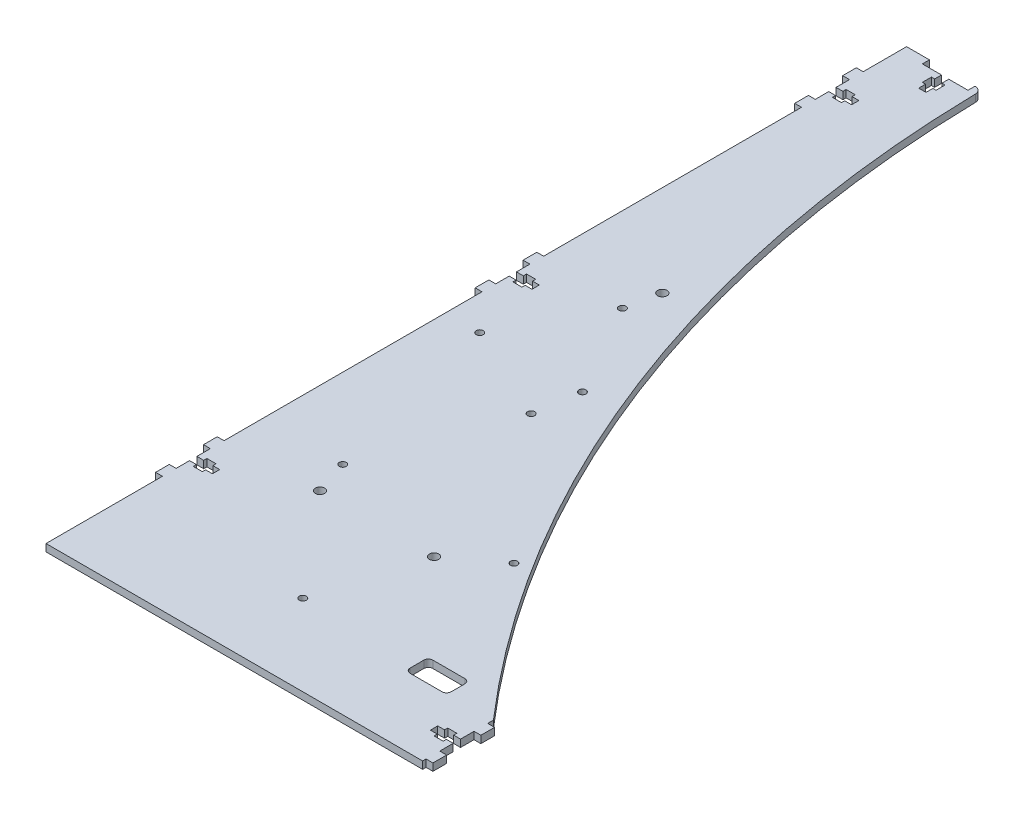
from build123d import *

# Parameters (mm, degrees)
SALIENTE_EXTRUIR1_DEPTH = 3.2
CORTAR_EXTRUIR1_DEPTH   = 3.2
REDONDEO1_R             = 3
CROQUIS3_R              = 2.05
CORTAR_EXTRUIR2_DEPTH   = 3.2
CORTAR_EXTRUIR3_DEPTH   = 3.2
CROQUIS5_R              = 1.55
CORTAR_EXTRUIR4_DEPTH   = 3.2


with BuildPart() as part:
    # Croquis1 → Saliente-Extruir1 (new body)
    with BuildSketch(Plane(origin=(0, 0, 0), x_dir=(1, 0, 0), z_dir=(0, 1, 0))):
        Polygon((7, 66.1), (10, 66.1), (10, 62.9), (7, 62.9), (7, 61.5), (3, 61.5), (3, 62.9), (0, 62.9), (0, 57), (-3, 57), (-3, 51), (0, 51), (0, 0), (165, 0), (165, 1.5), (168, 1.5), (168, 7.5), (165, 7.5), (165, 13.4), (162, 13.4), (162, 12), (158, 12), (158, 13.4), (155, 13.4), (155, 16.6), (158, 16.6), (158, 18), (162, 18), (162, 16.6), (165, 16.6), (165, 22.5), (168, 22.5), (168, 28.5), (165, 28.5), (165, 377), (30, 377), (30, 373.9), (21.6, 373.9), (21.6, 370.9), (23, 370.9), (23, 366.9), (21.6, 366.9), (21.6, 363.9), (18.4, 363.9), (18.4, 366.9), (17, 366.9), (17, 370.9), (18.4, 370.9), (18.4, 373.9), (10, 373.9), (10, 377), (0, 377), (0, 358), (-3, 358), (-3, 352), (0, 352), (0, 346.1), (3, 346.1), (3, 347.5), (7, 347.5), (7, 346.1), (10, 346.1), (10, 342.9), (7, 342.9), (7, 341.5), (3, 341.5), (3, 342.9), (0, 342.9), (0, 337), (-3, 337), (-3, 331), (0, 331), (0, 218), (-3, 218), (-3, 212), (0, 212), (0, 206.1), (3, 206.1), (3, 207.5), (7, 207.5), (7, 206.1), (10, 206.1), (10, 202.9), (7, 202.9), (7, 201.5), (3, 201.5), (3, 202.9), (0, 202.9), (0, 197), (-3, 197), (-3, 191), (0, 191), (0, 78), (-3, 78), (-3, 72), (0, 72), (0, 66.1), (3, 66.1), (3, 67.5), (7, 67.5), align=None)
    extrude(amount=SALIENTE_EXTRUIR1_DEPTH)

    # Croquis2 → Cortar-Extruir1 (cut)
    with BuildSketch(Plane.XZ):
        with BuildLine():
            Line((165, -377), (33, -377))
            ThreePointArc((33, -377), (68.343071274, -192.304293087), (165, -31))
            Line((165, -31), (165, -377))
        make_face()
    extrude(amount=-CORTAR_EXTRUIR1_DEPTH, mode=Mode.SUBTRACT)

    # Redondeo1
    redondeo1_edges = [part.edges().sort_by_distance(p)[0] for p in [
        (33, 1.6, -377),
    ]]
    fillet(redondeo1_edges, radius=REDONDEO1_R)

    # Croquis3 → Cortar-Extruir2 (cut)
    with BuildSketch(Plane(origin=(0, 3.2, 0), x_dir=(1, 0, 0), z_dir=(0, 1, 0))):
        with Locations(Location((40, 80, 0), (0, 0, 270))):
            Circle(CROQUIS3_R)
        with Locations(Location((90, 80, 0), (0, 0, 270))):
            Circle(CROQUIS3_R)
        with Locations(Location((40, 230, 0), (0, 0, 270))):
            Circle(CROQUIS3_R)
    extrude(amount=-CORTAR_EXTRUIR2_DEPTH, mode=Mode.SUBTRACT)

    # Croquis4 → Cortar-Extruir3 (cut)
    with BuildSketch(Plane.XZ):
        with BuildLine():
            Line((143, -30.5), (129, -30.5))
            ThreePointArc((129, -30.5), (127.585786438, -31.085786438), (127, -32.5))
            Line((127, -32.5), (127, -38.5))
            ThreePointArc((127, -38.5), (127.585786438, -39.914213562), (129, -40.5))
            Line((129, -40.5), (143, -40.5))
            ThreePointArc((143, -40.5), (144.414213562, -39.914213562), (145, -38.5))
            Line((145, -38.5), (145, -32.5))
            ThreePointArc((145, -32.5), (144.414213562, -31.085786438), (143, -30.5))
        make_face()
    extrude(amount=-CORTAR_EXTRUIR3_DEPTH, mode=Mode.SUBTRACT)

    # Croquis5 → Cortar-Extruir4 (cut)
    with BuildSketch(Plane.XZ):
        with Locations(Location((110, -95, 0), (0, 0, 270))):
            Circle(CROQUIS5_R)
        with Locations(Location((35, -95, 0), (0, 0, 270))):
            Circle(CROQUIS5_R)
        with Locations(Location((15, -175, 0), (0, 0, 270))):
            Circle(CROQUIS5_R)
        with Locations(Location((60, -175, 0), (0, 0, 270))):
            Circle(CROQUIS5_R)
        with Locations(Location((77, -35.5, 0), (0, 0, 270))):
            Circle(CROQUIS5_R)
        with Locations(Location((37, -215.5, 0), (0, 0, 270))):
            Circle(CROQUIS5_R)
        with Locations(Location((57, -155.5, 0), (0, 0, 270))):
            Circle(CROQUIS5_R)
    extrude(amount=-CORTAR_EXTRUIR4_DEPTH, mode=Mode.SUBTRACT)


solid = part.part
